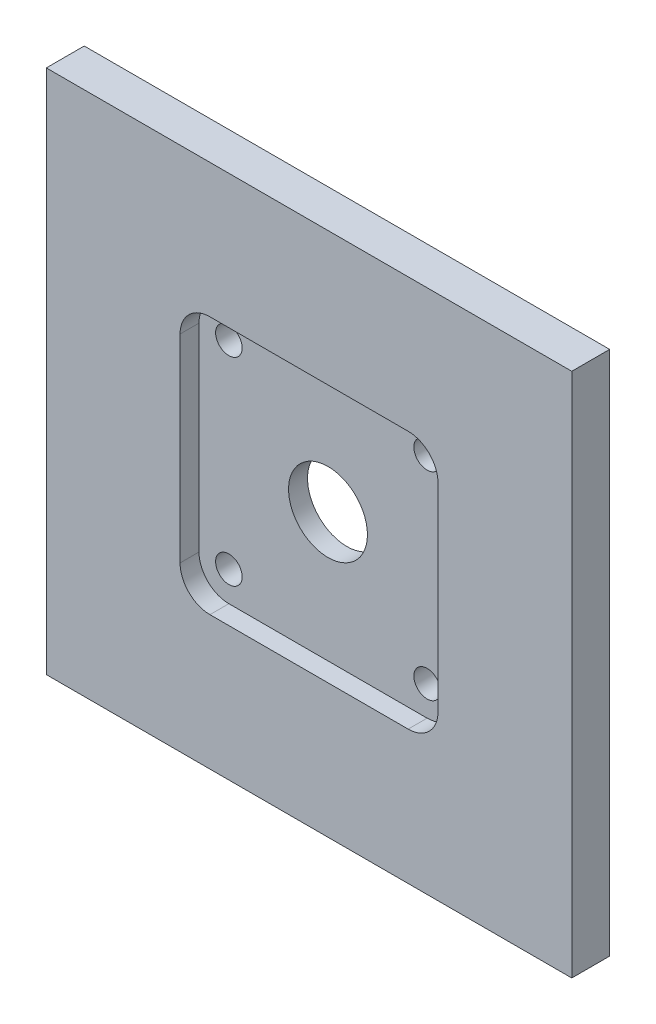
from build123d import *

# Parameters (mm, degrees)
SKETCH2_W                                  = 220
SKETCH2_H                                  = 220
BOSS_EXTRUDE1_DEPTH                        = 15.875
SKETCH4_W                                  = 108
SKETCH4_H                                  = 108
CUT_EXTRUDE1_DEPTH                         = 7.9375
FILLET1_R                                  = 12.5
SKETCH5_R                                  = 5.55625
CUT_EXTRUDE2_DEPTH                         = 156.765862455
MIRROR1_AT_THE_SECOND_PLANE_COPY_1_SKETC_R = 5.55625
MIRROR1_AT_THE_SECOND_PLANE_COPY_1_DEPTH   = 156.765862455
SKETCH6_R                                  = 16.51
CUT_EXTRUDE3_DEPTH                         = 156.765862455


with BuildPart() as part:
    # Sketch2 → Boss-Extrude1 (new body)
    with BuildSketch(Plane.XY):
        Rectangle(SKETCH2_W, SKETCH2_H)
    extrude(amount=BOSS_EXTRUDE1_DEPTH)

    # Sketch4 → Cut-Extrude1 (cut)
    with BuildSketch(Plane.XY.offset(15.875)):
        Rectangle(SKETCH4_W, SKETCH4_H)
    extrude(amount=-CUT_EXTRUDE1_DEPTH, mode=Mode.SUBTRACT)

    # Fillet1
    fillet1_edges = [part.edges().sort_by_distance(p)[0] for p in [
        (-54, -54, 11.90625),
        (-54, 54, 11.90625),
        (54, 54, 11.90625),
        (54, -54, 11.90625),
    ]]
    fillet(fillet1_edges, radius=FILLET1_R)

    # Sketch5 → Cut-Extrude2 (cut, through all)
    with BuildSketch(Plane.XY.offset(7.9375)):
        with Locations((-41.5, 41.5)):
            Circle(SKETCH5_R)
    cut_extrude2 = extrude(amount=-CUT_EXTRUDE2_DEPTH, mode=Mode.SUBTRACT)

    # Mirror1: Cut-Extrude2 across plane
    add(cut_extrude2.mirror(Plane.ZX), mode=Mode.SUBTRACT)

    # Mirror1 at the second plane: Cut-Extrude2 across plane
    add(cut_extrude2.mirror(Plane(origin=(0, 0, 0), x_dir=(0, 0, 1), z_dir=(1, 0, 0))), mode=Mode.SUBTRACT)

    # Mirror1 at the second plane copy 1 sketc → Mirror1 at the second plane copy 1 (cut, through all)
    with BuildSketch(Plane(origin=(0, 0, 7.9375), x_dir=(-1, 0, 0), z_dir=(0, 0, 1))):
        with Locations((-41.5, 41.5)):
            Circle(MIRROR1_AT_THE_SECOND_PLANE_COPY_1_SKETC_R)
    extrude(amount=-MIRROR1_AT_THE_SECOND_PLANE_COPY_1_DEPTH, mode=Mode.SUBTRACT)

    # Sketch6 → Cut-Extrude3 (cut, through all)
    with BuildSketch(Plane.XY.offset(7.9375)):
        Circle(SKETCH6_R)
    extrude(amount=-CUT_EXTRUDE3_DEPTH, mode=Mode.SUBTRACT)


solid = part.part
